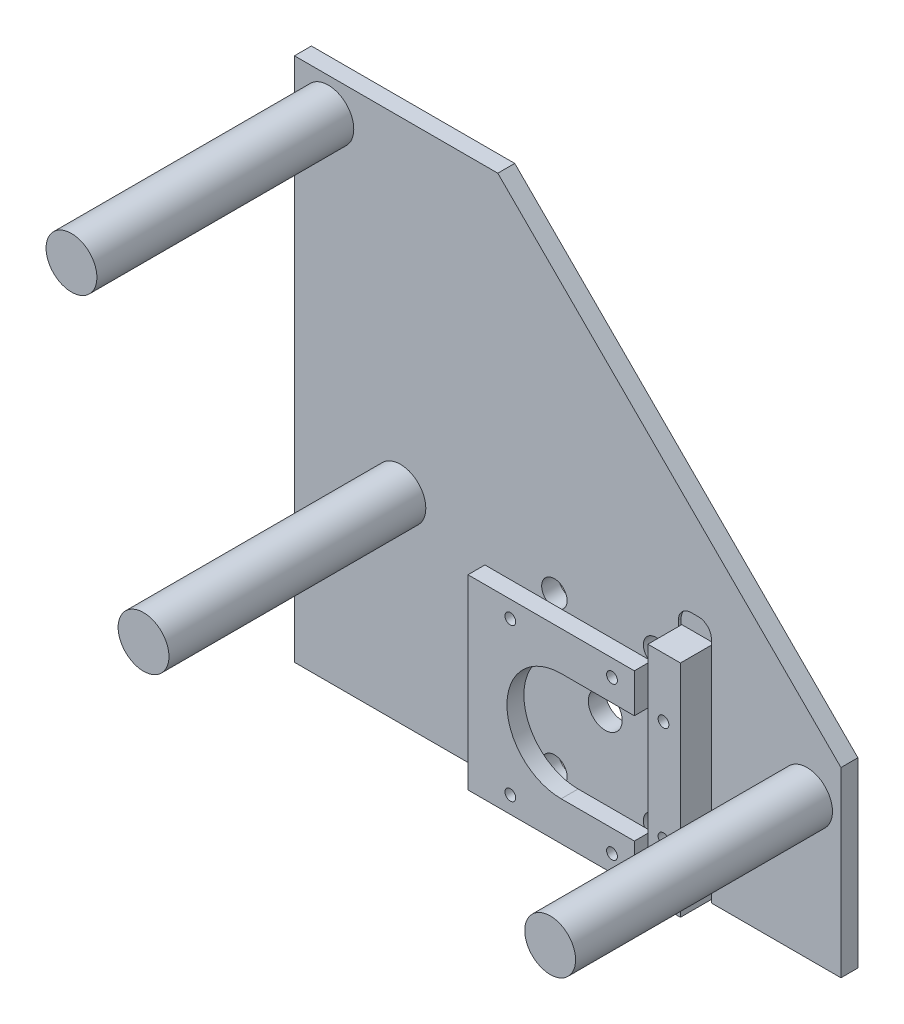
from build123d import *

# Parameters (mm, degrees)
SKETCH1_R             = 2.4257
BOSS_EXTRUDE1_DEPTH   = 6.35
SKETCH4_R             = 6.35
SKETCH4_R_2           = 4.7625
SKETCH4_R_3           = 2.4257
CUT_EXTRUDE1_DEPTH    = 12.7
CUT_EXTRUDE2_DEPTH    = 1.016
SKETCH2_R             = 9.525
BOSS_EXTRUDE2_DEPTH   = 96.266
BOSS_EXTRUDE2_2_DEPTH = 96.266
BOSS_EXTRUDE2_3_DEPTH = 96.266
SKETCH3_W             = 12.192
SKETCH3_H             = 82.55
SKETCH3_R             = 2.0193
BOSS_EXTRUDE3_DEPTH   = 12.7
SKETCH5_R             = 2.0193
BOSS_EXTRUDE4_DEPTH   = 6.35


with BuildPart() as part:
    # Sketch1 → Boss-Extrude1 (new body)
    with BuildSketch(Plane.XY):
        Polygon((-131.7752, 23.8252), (-131.7752, -173.0248), (73.025, -173.0248), (73.025, -104.775), (-55.5752, 23.8252), align=None)
        with Locations((-92.075, -98.425)):
            Circle(SKETCH1_R, mode=Mode.SUBTRACT)
        with Locations((-119.0752, 11.1252)):
            Circle(SKETCH1_R, mode=Mode.SUBTRACT)
        with Locations((60.325, -120.65)):
            Circle(SKETCH1_R, mode=Mode.SUBTRACT)
    extrude(amount=-BOSS_EXTRUDE1_DEPTH)

    # Sketch4 → Cut-Extrude1 (cut)
    with BuildSketch(Plane.XY):
        with Locations((-15.3162, -130.5052)):
            Circle(SKETCH4_R)
        with Locations((3.7338, -101.9302)):
            Circle(SKETCH4_R_2)
        with Locations((-34.3662, -101.9302)):
            Circle(SKETCH4_R_2)
        with Locations((-34.3662, -159.0802)):
            Circle(SKETCH4_R_2)
        with Locations((3.7338, -159.0802)):
            Circle(SKETCH4_R_2)
        with Locations((18.2118, -111.4552)):
            Circle(SKETCH4_R_3)
        with Locations((18.2118, -149.5552)):
            Circle(SKETCH4_R_3)
    extrude(amount=-CUT_EXTRUDE1_DEPTH, mode=Mode.SUBTRACT)

    # Sketch6 → Cut-Extrude2 (cut)
    with BuildSketch(Plane.XY):
        with BuildLine():
            Line((12.1158, -87.3252), (12.1158, -179.3748))
            ThreePointArc((12.1158, -179.3748), (13.514423698, -182.751376302), (16.891, -184.15))
            Line((16.891, -184.15), (19.685, -184.15))
            ThreePointArc((19.685, -184.15), (23.061576302, -182.751376302), (24.4602, -179.3748))
            Line((24.4602, -179.3748), (24.4602, -87.3252))
            ThreePointArc((24.4602, -87.3252), (23.061576302, -83.948623698), (19.685, -82.55))
            Line((19.685, -82.55), (16.891, -82.55))
            ThreePointArc((16.891, -82.55), (13.514423698, -83.948623698), (12.1158, -87.3252))
        make_face()
    extrude(amount=-CUT_EXTRUDE2_DEPTH, mode=Mode.SUBTRACT)


with BuildPart() as body_2:
    # Sketch2 → Boss-Extrude2 (new body)
    with BuildSketch(Plane.XY):
        with Locations((-119.0752, 11.1252)):
            Circle(SKETCH2_R)
    extrude(amount=BOSS_EXTRUDE2_DEPTH)


with BuildPart() as body_3:
    # Sketch2 → Boss-Extrude2 2 (new body)
    with BuildSketch(Plane.XY):
        with Locations((-92.075, -98.425)):
            Circle(SKETCH2_R)
    extrude(amount=BOSS_EXTRUDE2_2_DEPTH)


with BuildPart() as body_4:
    # Sketch2 → Boss-Extrude2 3 (new body)
    with BuildSketch(Plane.XY):
        with Locations((60.325, -120.65)):
            Circle(SKETCH2_R)
    extrude(amount=BOSS_EXTRUDE2_3_DEPTH)


with BuildPart() as body_5:
    # Sketch3 → Boss-Extrude3 (new body)
    with BuildSketch(Plane.XY.offset(-1.016)):
        with Locations((18.4658, -130.5052)):
            Rectangle(SKETCH3_W, SKETCH3_H)
        with Locations((18.2118, -111.4552)):
            Circle(SKETCH3_R, mode=Mode.SUBTRACT)
        with Locations((18.2118, -149.5552)):
            Circle(SKETCH3_R, mode=Mode.SUBTRACT)
    extrude(amount=BOSS_EXTRUDE3_DEPTH)


with BuildPart() as body_6:
    # Sketch5 → Boss-Extrude4 (new body)
    with BuildSketch(Plane.XY.offset(10.16)):
        with BuildLine():
            Line((12.1158, -95.5802), (-50.2412, -95.5802))
            Line((-50.2412, -95.5802), (-50.2412, -165.4302))
            Line((-50.2412, -165.4302), (12.1158, -165.4302))
            Line((12.1158, -165.4302), (12.1158, -150.8252))
            Line((12.1158, -150.8252), (-15.3162, -150.8252))
            ThreePointArc((-15.3162, -150.8252), (-35.6362, -130.5052), (-15.3162, -110.1852))
            Line((-15.3162, -110.1852), (12.1158, -110.1852))
            Line((12.1158, -110.1852), (12.1158, -95.5802))
        make_face()
        with Locations((3.7338, -101.9302)):
            Circle(SKETCH5_R, mode=Mode.SUBTRACT)
        with Locations((-34.3662, -101.9302)):
            Circle(SKETCH5_R, mode=Mode.SUBTRACT)
        with Locations((-34.3662, -159.0802)):
            Circle(SKETCH5_R, mode=Mode.SUBTRACT)
        with Locations((3.7338, -159.0802)):
            Circle(SKETCH5_R, mode=Mode.SUBTRACT)
    extrude(amount=BOSS_EXTRUDE4_DEPTH)


solid = Compound([part.part, body_2.part, body_3.part, body_4.part, body_5.part, body_6.part])
